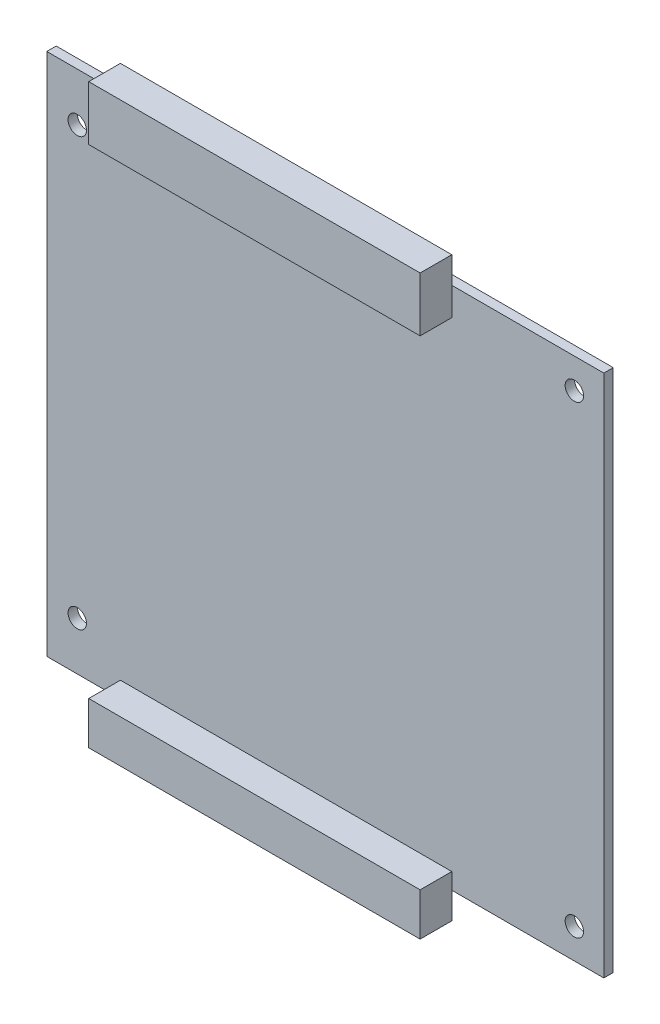
from build123d import *

# Parameters (mm, degrees)
SKETCH1_W            = 96.0628
SKETCH1_H            = 90.3478
PCB_DEPTH            = 1.6256
SKETCH5_R            = 1.5875
PCB_HOLES_DEPTH      = 66.957101229
SKETCH6_W            = 57.15
SKETCH6_H            = 7.366
SKETCH6_H_2          = 9.398
PCB_EDGE_CONNS_DEPTH = 5.461


with BuildPart() as part:
    # Sketch1 → PCB (new body)
    with BuildSketch(Plane.XY):
        Rectangle(SKETCH1_W, SKETCH1_H)
    extrude(amount=PCB_DEPTH)

    # Sketch5 → PCB_Holes (cut, through all)
    with BuildSketch(Plane.XY.offset(1.6256)):
        with Locations((-42.7736, 36.83)):
            Circle(SKETCH5_R)
        with Locations((42.9514, 40.005)):
            Circle(SKETCH5_R)
        with Locations((42.9514, -40.005)):
            Circle(SKETCH5_R)
        with Locations((-42.7736, -36.83)):
            Circle(SKETCH5_R)
    extrude(amount=-PCB_HOLES_DEPTH, mode=Mode.SUBTRACT)

    # Sketch6 → PCB_Edge_Conns (add)
    with BuildSketch(Plane.XY.offset(1.6256)):
        with Locations((-6.7564, -46.0629)):
            Rectangle(SKETCH6_W, SKETCH6_H)
        with Locations((-6.7564, 45.0469)):
            Rectangle(SKETCH6_W, SKETCH6_H_2)
    extrude(amount=PCB_EDGE_CONNS_DEPTH)


solid = part.part
